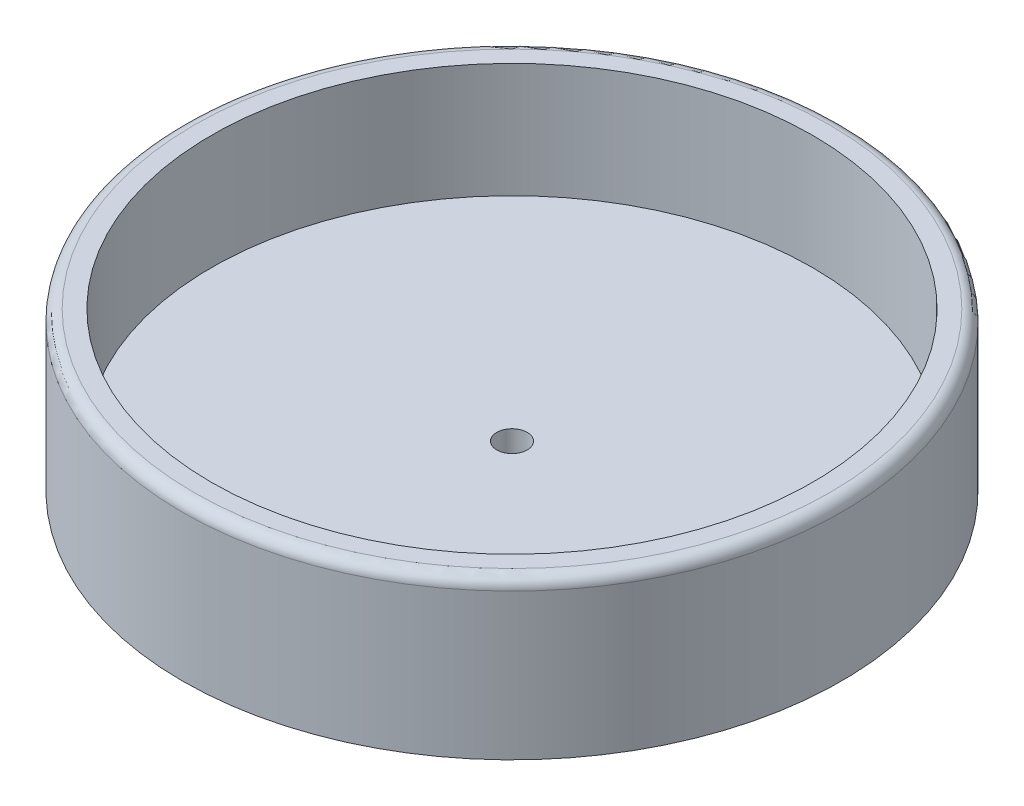
from build123d import *

# Parameters (mm, degrees)
SKETCH1_R                                           = 73.025
BOSS_EXTRUDE1_DEPTH                                 = 9.525
SKETCH2_R                                           = 73.025
SKETCH2_R_2                                         = 66.6115
BOSS_EXTRUDE2_DEPTH                                 = 25.4
CSK_FOR_1_4_FLAT_HEAD_MACHINE_SCREW_100_D           = 6.7564
CSK_FOR_1_4_FLAT_HEAD_MACHINE_SCREW_100_DEPTH       = 10.16
CSK_FOR_1_4_FLAT_HEAD_MACHINE_SCREW_100_CSINK_D     = 15.24
CSK_FOR_1_4_FLAT_HEAD_MACHINE_SCREW_100_CSINK_ANGLE = 100
CSK_FOR_1_4_FLAT_HEAD_MACHINE_SCREW_100_TIP         = 2.029827343
FILLET1_R                                           = 2.54


with BuildPart() as part:
    # Sketch1 → Boss-Extrude1 (new body)
    with BuildSketch(Plane(origin=(0, 0, 0), x_dir=(1, 0, 0), z_dir=(0, 1, 0))):
        with Locations(Location((0, 0, 0), (0, 0, 90))):
            Circle(SKETCH1_R)
    extrude(amount=BOSS_EXTRUDE1_DEPTH)

    # Sketch2 → Boss-Extrude2 (add)
    with BuildSketch(Plane(origin=(0, 9.525, 0), x_dir=(1, 0, 0), z_dir=(0, 1, 0))):
        with Locations(Location((0, 0, 0), (0, 0, 90))):
            Circle(SKETCH2_R)
        with Locations(Location((0, 0, 0), (0, 0, 270))):
            Circle(SKETCH2_R_2, mode=Mode.SUBTRACT)
    extrude(amount=BOSS_EXTRUDE2_DEPTH)

    # CSK for 1/4 Flat Head Machine Screw (100)1
    with Locations(Plane(origin=(0, 0, 0), x_dir=(-1, 0, 0), z_dir=(0, -1, 0))):
        with Locations((0, 0)):
            CounterSinkHole(CSK_FOR_1_4_FLAT_HEAD_MACHINE_SCREW_100_D / 2, CSK_FOR_1_4_FLAT_HEAD_MACHINE_SCREW_100_CSINK_D / 2, depth=CSK_FOR_1_4_FLAT_HEAD_MACHINE_SCREW_100_DEPTH, counter_sink_angle=CSK_FOR_1_4_FLAT_HEAD_MACHINE_SCREW_100_CSINK_ANGLE)
            with Locations((0, 0, -(CSK_FOR_1_4_FLAT_HEAD_MACHINE_SCREW_100_DEPTH + CSK_FOR_1_4_FLAT_HEAD_MACHINE_SCREW_100_TIP / 2))):  # 118° drill point
                Cone(0, CSK_FOR_1_4_FLAT_HEAD_MACHINE_SCREW_100_D / 2, CSK_FOR_1_4_FLAT_HEAD_MACHINE_SCREW_100_TIP, mode=Mode.SUBTRACT)

    # Fillet1
    fillet1_edges = [part.edges().sort_by_distance(p)[0] for p in [
        (0, 34.925, 73.025),
    ]]
    fillet(fillet1_edges, radius=FILLET1_R)


solid = part.part
